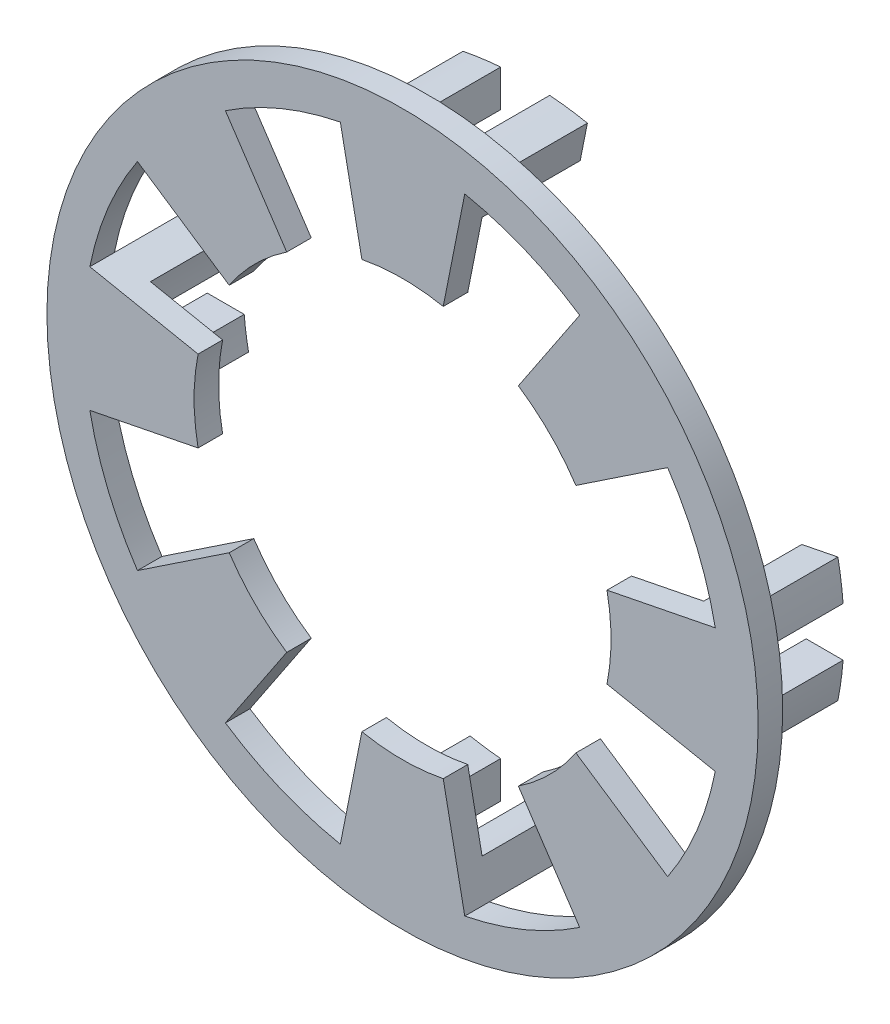
from build123d import *

# Parameters (mm, degrees)
SKETCH1_R           = 14.5
BOSS_EXTRUDE1_DEPTH = 1
BOSS_EXTRUDE2_START = 4
BOSS_EXTRUDE2_DEPTH = 4


with BuildPart() as part:
    # Sketch1 → Boss-Extrude1 (new body)
    with BuildSketch(Plane.XY):
        Circle(SKETCH1_R)
        with BuildLine():
            ThreePointArc((-1.658267737, 8.336674883), (0, 8.5), (1.658267737, 8.336674883))
            Line((1.658267737, 8.336674883), (2.536174186, 12.750208645))
            ThreePointArc((2.536174186, 12.750208645), (4.974884621, 12.010433923), (7.222413029, 10.80910496))
            Line((7.222413029, 10.80910496), (4.722346981, 7.067491705))
            ThreePointArc((4.722346981, 7.067491705), (6.01040764, 6.01040764), (7.067491705, 4.722346981))
            Line((7.067491705, 4.722346981), (10.80910496, 7.222413029))
            ThreePointArc((10.80910496, 7.222413029), (12.010433923, 4.974884621), (12.750208645, 2.536174186))
            Line((12.750208645, 2.536174186), (8.336674883, 1.658267737))
            ThreePointArc((8.336674883, 1.658267737), (8.5, 0), (8.336674883, -1.658267737))
            Line((8.336674883, -1.658267737), (12.750208645, -2.536174186))
            ThreePointArc((12.750208645, -2.536174186), (12.010433923, -4.974884621), (10.80910496, -7.222413029))
            Line((10.80910496, -7.222413029), (7.067491705, -4.722346981))
            ThreePointArc((7.067491705, -4.722346981), (6.01040764, -6.01040764), (4.722346981, -7.067491705))
            Line((4.722346981, -7.067491705), (7.222413029, -10.80910496))
            ThreePointArc((7.222413029, -10.80910496), (4.974884621, -12.010433923), (2.536174186, -12.750208645))
            Line((2.536174186, -12.750208645), (1.658267737, -8.336674883))
            ThreePointArc((1.658267737, -8.336674883), (0, -8.5), (-1.658267737, -8.336674883))
            Line((-1.658267737, -8.336674883), (-2.536174186, -12.750208645))
            ThreePointArc((-2.536174186, -12.750208645), (-4.974884621, -12.010433923), (-7.222413029, -10.80910496))
            Line((-7.222413029, -10.80910496), (-4.722346981, -7.067491705))
            ThreePointArc((-4.722346981, -7.067491705), (-6.01040764, -6.01040764), (-7.067491705, -4.722346981))
            Line((-7.067491705, -4.722346981), (-10.80910496, -7.222413029))
            ThreePointArc((-10.80910496, -7.222413029), (-12.010433923, -4.974884621), (-12.750208645, -2.536174186))
            Line((-12.750208645, -2.536174186), (-8.336674883, -1.658267737))
            ThreePointArc((-8.336674883, -1.658267737), (-8.5, 0), (-8.336674883, 1.658267737))
            Line((-8.336674883, 1.658267737), (-12.750208645, 2.536174186))
            ThreePointArc((-12.750208645, 2.536174186), (-12.010433923, 4.974884621), (-10.80910496, 7.222413029))
            Line((-10.80910496, 7.222413029), (-7.067491705, 4.722346981))
            ThreePointArc((-7.067491705, 4.722346981), (-6.01040764, 6.01040764), (-4.722346981, 7.067491705))
            Line((-4.722346981, 7.067491705), (-7.222413029, 10.80910496))
            ThreePointArc((-7.222413029, 10.80910496), (-4.974884621, 12.010433923), (-2.536174186, 12.750208645))
            Line((-2.536174186, 12.750208645), (-1.658267737, 8.336674883))
        make_face(mode=Mode.SUBTRACT)
    extrude(amount=BOSS_EXTRUDE1_DEPTH)

    # Sketch2 → Boss-Extrude2 (add)
    with BuildSketch(Plane(origin=(0, 0, 0), x_dir=(-1, 0, 0), z_dir=(0, 0, -1)).offset(BOSS_EXTRUDE2_START)):
        with BuildLine():
            Line((2.536174186, -12.750208645), (2.243538703, -11.279030725))
            ThreePointArc((2.243538703, -11.279030725), (1.624193423, -11.384726423), (1, -11.456439237))
            Line((1, -11.456439237), (1, -12.961481397))
            ThreePointArc((1, -12.961481397), (1.771239965, -12.8787697), (2.536174186, -12.750208645))
        make_face()
        with BuildLine():
            Line((-1, -12.961481397), (-1, -11.456439237))
            ThreePointArc((-1, -11.456439237), (-1.624193423, -11.384726423), (-2.243538703, -11.279030725))
            Line((-2.243538703, -11.279030725), (-2.536174186, -12.750208645))
            ThreePointArc((-2.536174186, -12.750208645), (-1.771239965, -12.8787697), (-1, -12.961481397))
        make_face()
        with BuildLine():
            Line((12.961481397, -1), (11.456439237, -1))
            ThreePointArc((11.456439237, -1), (11.384726423, -1.624193423), (11.279030725, -2.243538703))
            Line((11.279030725, -2.243538703), (12.750208645, -2.536174186))
            ThreePointArc((12.750208645, -2.536174186), (12.8787697, -1.771239965), (12.961481397, -1))
        make_face()
        with BuildLine():
            Line((12.750208645, 2.536174186), (11.279030725, 2.243538703))
            ThreePointArc((11.279030725, 2.243538703), (11.384726423, 1.624193423), (11.456439237, 1))
            Line((11.456439237, 1), (12.961481397, 1))
            ThreePointArc((12.961481397, 1), (12.8787697, 1.771239965), (12.750208645, 2.536174186))
        make_face()
        with BuildLine():
            ThreePointArc((1, 11.456439237), (1.624193423, 11.384726423), (2.243538703, 11.279030725))
            Line((2.243538703, 11.279030725), (2.536174186, 12.750208645))
            ThreePointArc((2.536174186, 12.750208645), (1.771239965, 12.8787697), (1, 12.961481397))
            Line((1, 12.961481397), (1, 11.456439237))
        make_face()
        with BuildLine():
            ThreePointArc((-2.243538703, 11.279030725), (-1.624193423, 11.384726423), (-1, 11.456439237))
            Line((-1, 11.456439237), (-1, 12.961481397))
            ThreePointArc((-1, 12.961481397), (-1.771239965, 12.8787697), (-2.536174186, 12.750208645))
            Line((-2.536174186, 12.750208645), (-2.243538703, 11.279030725))
        make_face()
        with BuildLine():
            ThreePointArc((-11.456439237, 1), (-11.384726423, 1.624193423), (-11.279030725, 2.243538703))
            Line((-11.279030725, 2.243538703), (-12.750208645, 2.536174186))
            ThreePointArc((-12.750208645, 2.536174186), (-12.8787697, 1.771239965), (-12.961481397, 1))
            Line((-12.961481397, 1), (-11.456439237, 1))
        make_face()
        with BuildLine():
            ThreePointArc((-11.279030725, -2.243538703), (-11.384726423, -1.624193423), (-11.456439237, -1))
            Line((-11.456439237, -1), (-12.961481397, -1))
            ThreePointArc((-12.961481397, -1), (-12.8787697, -1.771239965), (-12.750208645, -2.536174186))
            Line((-12.750208645, -2.536174186), (-11.279030725, -2.243538703))
        make_face()
    extrude(amount=-BOSS_EXTRUDE2_DEPTH)


solid = part.part
